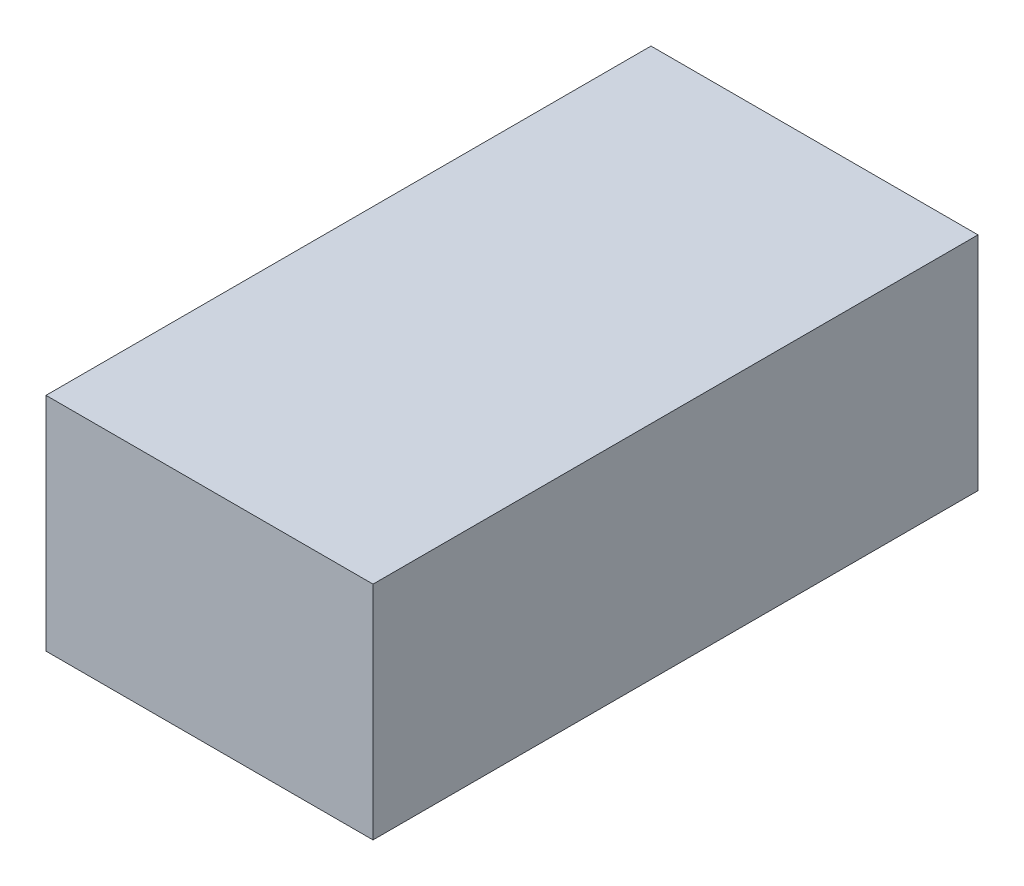
from build123d import *

# Parameters (mm, degrees)
AIR_BOX_START      = -800
SKETCH1_W          = 3700
SKETCH1_H          = 1355
AIR_BOX_DEPTH      = 2000
WHEEL_START        = -190
SKETCH2_R          = 360
SKETCH2_R_2        = 200
WHEEL_DEPTH        = 285
COVER_START        = -200
SKETCH3_R          = 360
COVER_DEPTH        = 10
SKETCH4_R          = 164
ROTOR_DEPTH        = 16
THROAT_OUTER_START = 18
SKETCH5_W          = 64
SKETCH5_H          = 104
THROAT_OUTER_DEPTH = 82
SCOOP_OUTER_START  = 98
SKETCH6_W          = 332
SKETCH6_H          = 104
SCOOP_OUTER_DEPTH  = 64
THROAT_INNER_START = 10
SKETCH7_W          = 60
SKETCH7_H          = 100
THROAT_INNER_DEPTH = 91
SCOOP_INNER_START  = 100
SKETCH8_W          = 340
SKETCH8_H          = 100
SCOOP_INNER_DEPTH  = 60
LOUVER1_START      = 57
SKETCH9_W          = 56
SKETCH9_H          = 18
LOUVER1_DEPTH      = 2
LOUVER2_START      = 57
SKETCH10_W         = 56
SKETCH10_H         = 18
LOUVER2_DEPTH      = 2
LOUVER3_START      = 57
SKETCH11_W         = 56
SKETCH11_H         = 18
LOUVER3_DEPTH      = 2
LOUVER4_START      = 57
SKETCH12_W         = 56
SKETCH12_H         = 18
LOUVER4_DEPTH      = 2


with BuildPart() as part:
    # Sketch1 → air_box (new body)
    with BuildSketch(Plane(origin=(0, 0, 0), x_dir=(0, 0, -1), z_dir=(1, 0, 0)).offset(AIR_BOX_START)):
        with Locations((650, 322.5)):
            Rectangle(SKETCH1_W, SKETCH1_H)
    extrude(amount=AIR_BOX_DEPTH)


with BuildPart() as body_2:
    # Sketch2 → wheel (new body)
    with BuildSketch(Plane(origin=(0, 0, 0), x_dir=(0, 0, -1), z_dir=(1, 0, 0)).offset(WHEEL_START)):
        Circle(SKETCH2_R)
        Circle(SKETCH2_R_2, mode=Mode.SUBTRACT)
    extrude(amount=WHEEL_DEPTH)


with BuildPart() as body_3:
    # Sketch3 → cover (new body)
    with BuildSketch(Plane(origin=(0, 0, 0), x_dir=(0, 0, -1), z_dir=(1, 0, 0)).offset(COVER_START)):
        Circle(SKETCH3_R)
    extrude(amount=COVER_DEPTH)


with BuildPart() as body_4:
    # Sketch4 → rotor (new, symmetric)
    with BuildSketch(Plane(origin=(0, 0, 0), x_dir=(0, 0, -1), z_dir=(1, 0, 0))):
        Circle(SKETCH4_R)
    extrude(amount=ROTOR_DEPTH, both=True)


with BuildPart() as body_5:
    # Sketch5 → throat_outer (new body)
    with BuildSketch(Plane(origin=(0, 0, 0), x_dir=(0, 0, -1), z_dir=(1, 0, 0)).offset(THROAT_OUTER_START)):
        with Locations((0, 140)):
            Rectangle(SKETCH5_W, SKETCH5_H)
    extrude(amount=THROAT_OUTER_DEPTH)


with BuildPart() as body_6:
    # Sketch6 → scoop_outer (new body)
    with BuildSketch(Plane(origin=(0, 0, 0), x_dir=(0, 0, -1), z_dir=(1, 0, 0)).offset(SCOOP_OUTER_START)):
        with Locations((-134, 140)):
            Rectangle(SKETCH6_W, SKETCH6_H)
    extrude(amount=SCOOP_OUTER_DEPTH)

    # Combine1: union body 5
    add(body_5.part)


with BuildPart() as body_6_2:
    # Sketch7 → throat_inner (new body)
    with BuildSketch(Plane(origin=(0, 0, 0), x_dir=(0, 0, -1), z_dir=(1, 0, 0)).offset(THROAT_INNER_START)):
        with Locations((0, 140)):
            Rectangle(SKETCH7_W, SKETCH7_H)
    extrude(amount=THROAT_INNER_DEPTH)


with BuildPart() as body_7:
    # Sketch8 → scoop_inner (new body)
    with BuildSketch(Plane(origin=(0, 0, 0), x_dir=(0, 0, -1), z_dir=(1, 0, 0)).offset(SCOOP_INNER_START)):
        with Locations((-140, 140)):
            Rectangle(SKETCH8_W, SKETCH8_H)
    extrude(amount=SCOOP_INNER_DEPTH)


with BuildPart() as body_6_1:
    add(body_6.part)

    # Combine2: cut body 6 2, body 7
    add(body_6_2.part, mode=Mode.SUBTRACT)
    add(body_7.part, mode=Mode.SUBTRACT)


with BuildPart() as body_6_3:
    # Sketch9 → louver1 (new body)
    with BuildSketch(Plane(origin=(0, 0, 0), x_dir=(0, 0, -1), z_dir=(1, 0, 0)).offset(LOUVER1_START)):
        with Locations((0, 110)):
            Rectangle(SKETCH9_W, SKETCH9_H)
    extrude(amount=LOUVER1_DEPTH)


with BuildPart() as body_7_2:
    # Sketch10 → louver2 (new body)
    with BuildSketch(Plane(origin=(0, 0, 0), x_dir=(0, 0, -1), z_dir=(1, 0, 0)).offset(LOUVER2_START)):
        with Locations((0, 130)):
            Rectangle(SKETCH10_W, SKETCH10_H)
    extrude(amount=LOUVER2_DEPTH)


with BuildPart() as body_8:
    # Sketch11 → louver3 (new body)
    with BuildSketch(Plane(origin=(0, 0, 0), x_dir=(0, 0, -1), z_dir=(1, 0, 0)).offset(LOUVER3_START)):
        with Locations((0, 150)):
            Rectangle(SKETCH11_W, SKETCH11_H)
    extrude(amount=LOUVER3_DEPTH)


with BuildPart() as body_9:
    # Sketch12 → louver4 (new body)
    with BuildSketch(Plane(origin=(0, 0, 0), x_dir=(0, 0, -1), z_dir=(1, 0, 0)).offset(LOUVER4_START)):
        with Locations((0, 170)):
            Rectangle(SKETCH12_W, SKETCH12_H)
    extrude(amount=LOUVER4_DEPTH)


with BuildPart() as part_1:
    add(part.part)

    # Combine3: cut body 2
    add(body_2.part, mode=Mode.SUBTRACT)

    # Combine4: cut body 3
    add(body_3.part, mode=Mode.SUBTRACT)

    # Combine5: cut body 4
    add(body_4.part, mode=Mode.SUBTRACT)

    # Combine6: cut body 6
    add(body_6_1.part, mode=Mode.SUBTRACT)

    # Combine7: cut body 6 3
    add(body_6_3.part, mode=Mode.SUBTRACT)

    # Combine8: cut body 7 2
    add(body_7_2.part, mode=Mode.SUBTRACT)

    # Combine9: cut body 8
    add(body_8.part, mode=Mode.SUBTRACT)

    # Combine10: cut body 9
    add(body_9.part, mode=Mode.SUBTRACT)


solid = part_1.part
